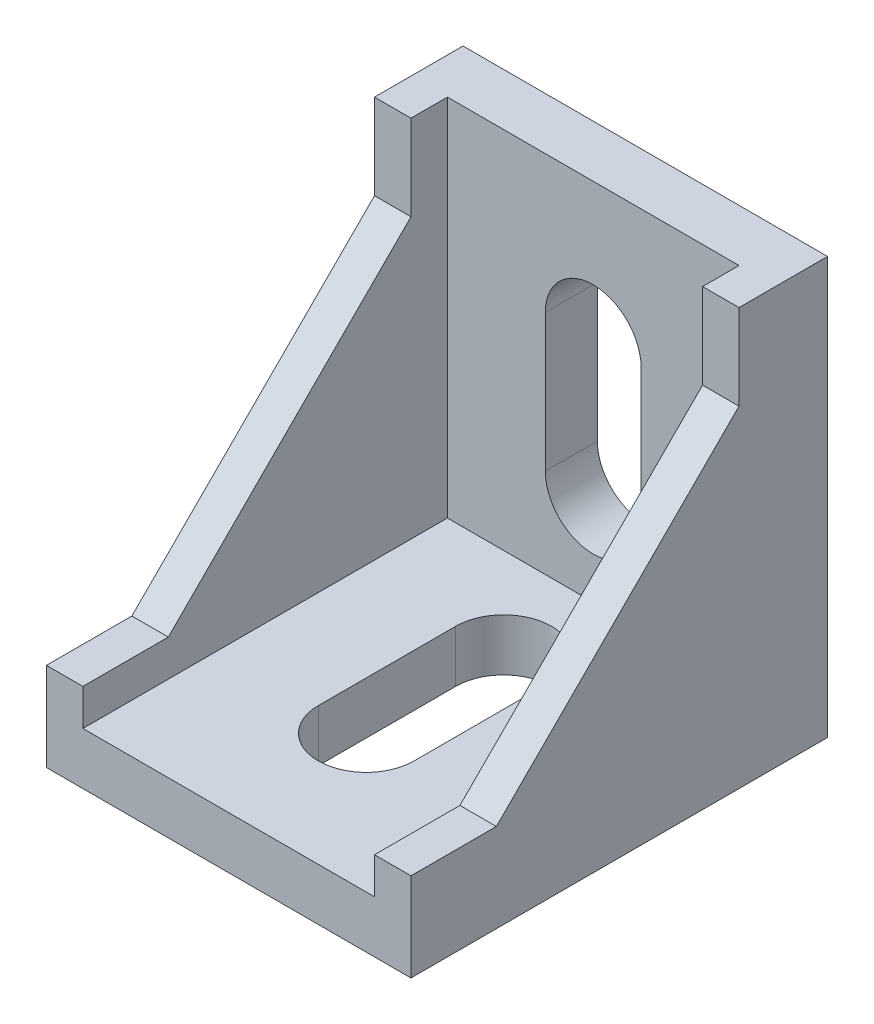
from build123d import *

# Parameters (mm, degrees)
SKETCH_3_W      = 35
SKETCH_3_H      = 40
EXTRUDE_1_DEPTH = 5
EXTRUDE_2_DEPTH = 3.5
SKETCH_5_W      = 35
SKETCH_5_H      = 40
EXTRUDE_3_DEPTH = 5
SKETCH_6_W      = 2
SKETCH_6_H      = 1.5
SKETCH_6_W_2    = 1.5
SKETCH_6_H_2    = 2
EXTRUDE_4_DEPTH = 3.1


with BuildPart() as part:
    # 草图3 → 凸台-拉伸1 (new body)
    with BuildSketch(Plane.XY):
        with Locations((0, 20)):
            Rectangle(SKETCH_3_W, SKETCH_3_H)
        with BuildLine():
            Line((4.6, 26.8), (4.6, 13.6))
            ThreePointArc((4.6, 13.6), (0, 9), (-4.6, 13.6))
            Line((-4.6, 13.6), (-4.6, 26.8))
            ThreePointArc((-4.6, 26.8), (0, 31.4), (4.6, 26.8))
        make_face(mode=Mode.SUBTRACT)
    extrude(amount=EXTRUDE_1_DEPTH)

    # 草图4 → 凸台-拉伸2 (add)
    with BuildSketch(Plane.ZY.offset(17.5)):
        Polygon((5, 40), (8.5, 40), (8.5, 31.8), (31.8, 8.5), (40, 8.5), (40, 0), (5, 0), align=None)
    extrude_2 = extrude(amount=-EXTRUDE_2_DEPTH)

    # 镜向1: 凸台-拉伸2 across plane
    add(extrude_2.mirror(Plane(origin=(0, 0, 0), x_dir=(0, 0, 1), z_dir=(1, 0, 0))))

    # 草图5 → 凸台-拉伸3 (add)
    with BuildSketch(Plane.XZ):
        with Locations((0, 20)):
            Rectangle(SKETCH_5_W, SKETCH_5_H)
        with BuildLine():
            Line((4.6, 26.8), (4.6, 13.6))
            ThreePointArc((4.6, 13.6), (0, 9), (-4.6, 13.6))
            Line((-4.6, 13.6), (-4.6, 26.8))
            ThreePointArc((-4.6, 26.8), (0, 31.4), (4.6, 26.8))
        make_face(mode=Mode.SUBTRACT)
    extrude(amount=-EXTRUDE_3_DEPTH)

    # 草图6 → 凸台-拉伸4 (add, symmetric)
    with BuildSketch(Plane(origin=(0, 0, 0), x_dir=(0, 0, -1), z_dir=(1, 0, 0))):
        with Locations((-35, -0.75)):
            Rectangle(SKETCH_6_W, SKETCH_6_H)
        with Locations((-5, -0.75)):
            Rectangle(SKETCH_6_W, SKETCH_6_H)
        with Locations((0.75, 5)):
            Rectangle(SKETCH_6_W_2, SKETCH_6_H_2)
        with Locations((0.75, 35)):
            Rectangle(SKETCH_6_W_2, SKETCH_6_H_2)
    extrude(amount=EXTRUDE_4_DEPTH, both=True)


solid = part.part
